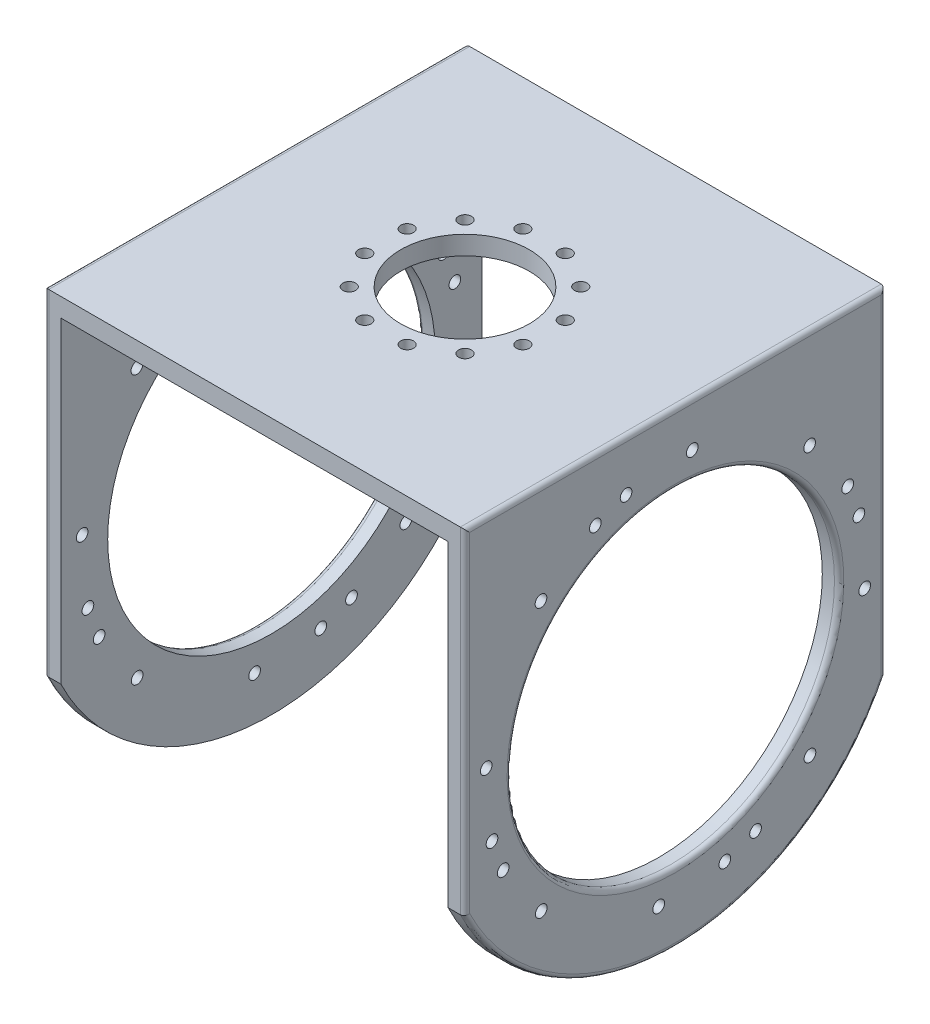
from build123d import *

# Parameters (mm, degrees)
EXTRUDE_1_DEPTH          = 180
SKETCH_2_R               = 27.5
CUT_EXTRUDE_1_DEPTH      = 180
SKETCH_3_R               = 70
CUT_EXTRUDE_2_DEPTH      = 217
CUT_EXTRUDE_5_DEPTH      = 324.728281125
CUT_EXTRUDE_5_DEPTH_BACK = 324.728281125
FILLET_2_R               = 2
CUT_EXTRUDE_6_DEPTH      = 324.728281298
CUT_EXTRUDE_6_DEPTH_BACK = 324.728281298
SKETCH_10_R              = 2.5
SKETCH_11_R              = 2.75
CUT_EXTRUDE_7_DEPTH      = 29


with BuildPart() as part:
    # 草图1 → 凸台-拉伸1 (new body)
    with BuildSketch(Plane.XY):
        Polygon((-90, 200), (90, 200), (90, 0), (82.8, 0), (82.8, 192), (-82.8, 192), (-82.8, 0), (-90, 0), align=None)
    extrude(amount=EXTRUDE_1_DEPTH)

    # 草图2 → 切除-拉伸1 (cut)
    with BuildSketch(Plane(origin=(0, 200, 0), x_dir=(1, 0, 0), z_dir=(0, 1, 0))):
        with Locations(Location((0, -90, 0), (0, 0, 270))):
            Circle(SKETCH_2_R)
    extrude(amount=-CUT_EXTRUDE_1_DEPTH, mode=Mode.SUBTRACT)

    # 草图3 → 切除-拉伸2 (cut)
    with BuildSketch(Plane(origin=(90, 0, 0), x_dir=(0, 0, -1), z_dir=(1, 0, 0))):
        with Locations(Location((-90, 100, 0), (0, 0, 90))):
            Circle(SKETCH_3_R)
    extrude(amount=-CUT_EXTRUDE_2_DEPTH, mode=Mode.SUBTRACT)

    # 草图9 → 切除-拉伸5 (cut, two sides: drawn at the far end of the back side and taken through both)
    with BuildSketch(Plane(origin=(90, 0, 0), x_dir=(0, 0, -1), z_dir=(1, 0, 0)).offset(-CUT_EXTRUDE_5_DEPTH_BACK)):
        with BuildLine():
            Line((0, 0), (0, 56.411010565))
            ThreePointArc((0, 56.411010565), (-36.891144692, 15.268367844), (-90.000000357, 0))
            Line((-90.000000357, 0), (0, 0))
        make_face()
        with BuildLine():
            Line((-180, 0), (-90.000000357, 0))
            ThreePointArc((-90.000000357, 0), (-143.108855611, 15.268368034), (-180, 56.411010565))
            Line((-180, 56.411010565), (-180, 0))
        make_face()
    extrude(amount=CUT_EXTRUDE_5_DEPTH + CUT_EXTRUDE_5_DEPTH_BACK, mode=Mode.SUBTRACT)

    # 圆角2
    fillet_2_edges = [part.edges().sort_by_distance(p)[0] for p in [
        (-90, 128.205505282, 0),
        (-90, 128.205505282, 180),
        (-90, 200, 90),
        (90, 200, 90),
        (-90, 30, 90),
        (90, 30, 90),
        (90, 128.205505282, 0),
        (90, 0, 90),
        (-90, 0, 90),
        (90, 128.205505282, 180),
    ]]
    fillet(fillet_2_edges, radius=FILLET_2_R)

    # 草图10 → 切除-拉伸6 (cut, two sides: drawn at the far end of the back side and taken through both)
    with BuildSketch(Plane(origin=(90, 0, 0), x_dir=(0, 0, -1), z_dir=(1, 0, 0)).offset(-CUT_EXTRUDE_6_DEPTH_BACK)):
        with Locations(Location((-32.609998318, 157.514782508, 0), (0, 0, 90))):
            Circle(SKETCH_10_R)
        with Locations(Location((-16.325246691, 134.257746931, 0), (0, 0, 90))):
            Circle(SKETCH_10_R)
        with Locations(Location((-11.541409366, 121.114261903, 0), (0, 0, 90))):
            Circle(SKETCH_10_R)
        with Locations(Location((-9.066918551, 92.830702464, 0), (0, 0, 90))):
            Circle(SKETCH_10_R)
        with Locations(Location((-32.485217492, 42.609998318, 0), (0, 0, 90))):
            Circle(SKETCH_10_R)
        with Locations(Location((-55.742253069, 26.325246691, 0), (0, 0, 90))):
            Circle(SKETCH_10_R)
        with Locations(Location((-68.885738097, 21.541409366, 0), (0, 0, 90))):
            Circle(SKETCH_10_R)
        with Locations(Location((-97.169297536, 19.066918551, 0), (0, 0, 90))):
            Circle(SKETCH_10_R)
        with Locations(Location((-147.390001682, 42.485217492, 0), (0, 0, 90))):
            Circle(SKETCH_10_R)
        with Locations(Location((-163.674753309, 65.742253069, 0), (0, 0, 90))):
            Circle(SKETCH_10_R)
        with Locations(Location((-168.458590634, 78.885738097, 0), (0, 0, 90))):
            Circle(SKETCH_10_R)
        with Locations(Location((-170.933081449, 107.169297536, 0), (0, 0, 90))):
            Circle(SKETCH_10_R)
        with Locations(Location((-147.514782508, 157.390001682, 0), (0, 0, 90))):
            Circle(SKETCH_10_R)
        with Locations(Location((-124.257746931, 173.674753309, 0), (0, 0, 90))):
            Circle(SKETCH_10_R)
        with Locations(Location((-111.114261903, 178.458590634, 0), (0, 0, 90))):
            Circle(SKETCH_10_R)
        with Locations(Location((-82.830702464, 180.933081449, 0), (0, 0, 90))):
            Circle(SKETCH_10_R)
    extrude(amount=CUT_EXTRUDE_6_DEPTH + CUT_EXTRUDE_6_DEPTH_BACK, mode=Mode.SUBTRACT)

    # 草图11 → 切除-拉伸7 (cut)
    with BuildSketch(Plane.XZ.offset(-192)):
        with Locations(Location((9.058666579, 123.80740392, 0), (0, 0, 270))):
            Circle(SKETCH_11_R)
        with Locations(Location((24.748737342, 114.748737342, 0), (0, 0, 270))):
            Circle(SKETCH_11_R)
        with Locations(Location((33.80740392, 99.058666579, 0), (0, 0, 270))):
            Circle(SKETCH_11_R)
        with Locations(Location((33.80740392, 80.941333421, 0), (0, 0, 270))):
            Circle(SKETCH_11_R)
        with Locations(Location((24.748737342, 65.251262658, 0), (0, 0, 270))):
            Circle(SKETCH_11_R)
        with Locations(Location((9.058666579, 56.19259608, 0), (0, 0, 270))):
            Circle(SKETCH_11_R)
        with Locations(Location((-9.058666579, 56.19259608, 0), (0, 0, 270))):
            Circle(SKETCH_11_R)
        with Locations(Location((-24.748737342, 65.251262658, 0), (0, 0, 270))):
            Circle(SKETCH_11_R)
        with Locations(Location((-33.80740392, 80.941333421, 0), (0, 0, 270))):
            Circle(SKETCH_11_R)
        with Locations(Location((-33.80740392, 99.058666579, 0), (0, 0, 270))):
            Circle(SKETCH_11_R)
        with Locations(Location((-24.748737342, 114.748737342, 0), (0, 0, 270))):
            Circle(SKETCH_11_R)
        with Locations(Location((-9.058666579, 123.80740392, 0), (0, 0, 270))):
            Circle(SKETCH_11_R)
    extrude(amount=-CUT_EXTRUDE_7_DEPTH, mode=Mode.SUBTRACT)


solid = part.part
